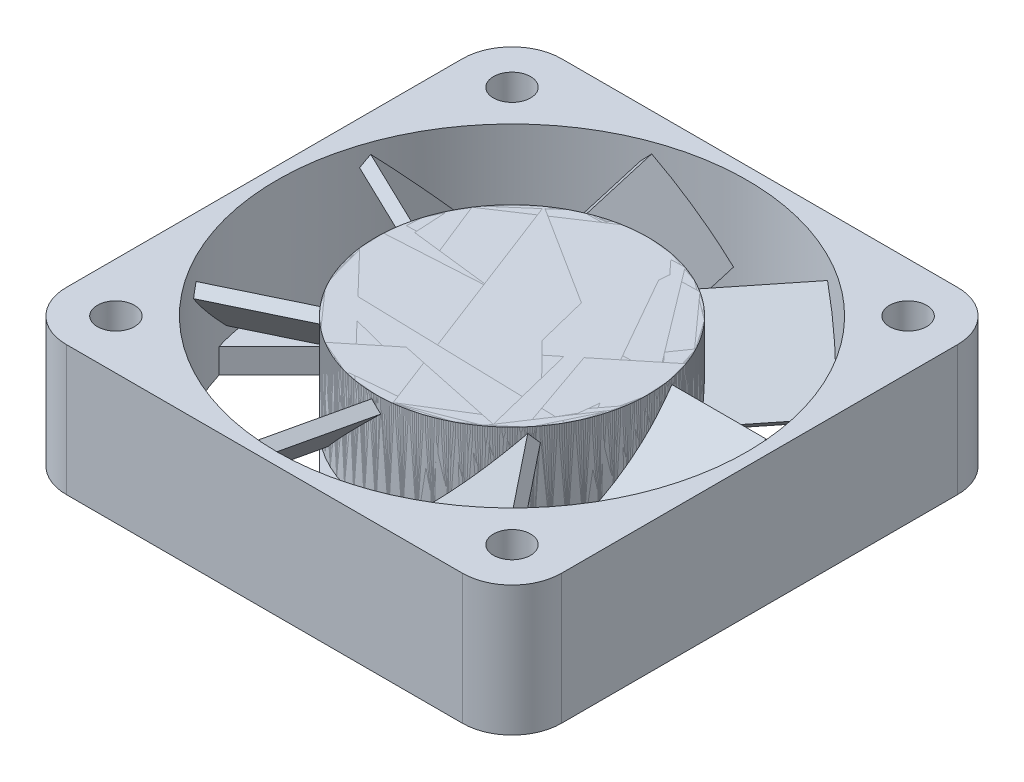
from build123d import *

# Parameters (mm, degrees)
SKETCH1_R                = 19
SKETCH1_R_2              = 1.5
BOSS_EXTRUDE1_DEPTH      = 10.5
BOSS_EXTRUDE2_DEPTH      = 2
SKETCH3_R                = 11
BOSS_EXTRUDE3_DEPTH      = 8
BOSS_EXTRUDE4_REACH      = 32.17
BOSS_EXTRUDE4_END_RADIUS = 18.5
CIRPATTERN3_COUNT        = 7


with BuildPart() as part:
    # Sketch1 → Boss-Extrude1 (new body)
    with BuildSketch(Plane(origin=(0, 0, 0), x_dir=(1, 0, 0), z_dir=(0, 1, 0))):
        with BuildLine():
            Line((-16, 20), (16, 20))
            ThreePointArc((16, 20), (18.828427125, 18.828427125), (20, 16))
            Line((20, 16), (20, -16))
            ThreePointArc((20, -16), (18.828427125, -18.828427125), (16, -20))
            Line((16, -20), (-16, -20))
            ThreePointArc((-16, -20), (-18.828427125, -18.828427125), (-20, -16))
            Line((-20, -16), (-20, 16))
            ThreePointArc((-20, 16), (-18.828427125, 18.828427125), (-16, 20))
        make_face()
        with Locations(Location((0, 0, 0), (0, 0, 90))):
            Circle(SKETCH1_R, mode=Mode.SUBTRACT)
        with Locations(Location((-16, 16, 0), (0, 0, 90))):
            Circle(SKETCH1_R_2, mode=Mode.SUBTRACT)
        with Locations(Location((16, 16, 0), (0, 0, 90))):
            Circle(SKETCH1_R_2, mode=Mode.SUBTRACT)
        with Locations(Location((16, -16, 0), (0, 0, 90))):
            Circle(SKETCH1_R_2, mode=Mode.SUBTRACT)
        with Locations(Location((-16, -16, 0), (0, 0, 90))):
            Circle(SKETCH1_R_2, mode=Mode.SUBTRACT)
    extrude(amount=BOSS_EXTRUDE1_DEPTH)

    # Sketch2 → Boss-Extrude2 (add)
    with BuildSketch(Plane.XZ):
        with BuildLine():
            Line((-7.778174593, 7.778174593), (3.176276557, 18.732625743))
            ThreePointArc((3.176276557, 18.732625743), (4.330553873, 18.499900085), (5.468198536, 18.196120597))
            Line((5.468198536, 18.196120597), (-1.891825076, 10.836096986))
            ThreePointArc((-1.891825076, 10.836096986), (3.31662479, 10.488088482), (7.778174593, 7.778174593))
            Line((7.778174593, 7.778174593), (18.732625743, -3.176276557))
            ThreePointArc((18.732625743, -3.176276557), (18.499900085, -4.330553873), (18.196120597, -5.468198536))
            Line((18.196120597, -5.468198536), (10.836096986, 1.891825076))
            ThreePointArc((10.836096986, 1.891825076), (10.488088482, -3.31662479), (7.778174593, -7.778174593))
            Line((7.778174593, -7.778174593), (-3.176276557, -18.732625743))
            ThreePointArc((-3.176276557, -18.732625743), (-4.330553873, -18.499900085), (-5.468198536, -18.196120597))
            Line((-5.468198536, -18.196120597), (1.891825076, -10.836096986))
            ThreePointArc((1.891825076, -10.836096986), (-3.31662479, -10.488088482), (-7.778174593, -7.778174593))
            Line((-7.778174593, -7.778174593), (-18.732625743, 3.176276557))
            ThreePointArc((-18.732625743, 3.176276557), (-18.499900085, 4.330553873), (-18.196120597, 5.468198536))
            Line((-18.196120597, 5.468198536), (-10.836096986, -1.891825076))
            ThreePointArc((-10.836096986, -1.891825076), (-10.488088482, 3.31662479), (-7.778174593, 7.778174593))
        make_face()
    extrude(amount=-BOSS_EXTRUDE2_DEPTH)


with BuildPart() as body_2:
    # Sketch3 → Boss-Extrude3 (new body)
    with BuildSketch(Plane(origin=(0, 10.5, 0), x_dir=(1, 0, 0), z_dir=(0, 1, 0))):
        with Locations(Location((0, 0, 0), (0, 0, 270))):
            Circle(SKETCH3_R)
    extrude(amount=-BOSS_EXTRUDE3_DEPTH)

    # Boss-Extrude4: up to this cylinder (the profile starts inside it)
    boss_extrude4_end = Plane(origin=(0, 6.853553, 0), z_dir=(0, -1, 0)) * Cylinder(BOSS_EXTRUDE4_END_RADIUS, 102.34, mode=Mode.PRIVATE)
    # Sketch4 → Boss-Extrude4 (add, up to the surface)
    with BuildSketch(Plane(origin=(0, 0, 0), x_dir=(0, 0, -1), z_dir=(1, 0, 0)), mode=Mode.PRIVATE) as boss_extrude4_sk1:
        Polygon((-3.535533906, 4.378679656), (2.121320344, 10.035533906), (2.828427125, 9.328427125), (-2.828427125, 3.671572875), align=None)
    boss_extrude4_tool1 = extrude(boss_extrude4_sk1.sketch, amount=BOSS_EXTRUDE4_REACH, mode=Mode.PRIVATE) & boss_extrude4_end
    add(boss_extrude4_tool1.solids().sort_by_distance((0, 6.853553, 0.353553))[0])


with BuildPart() as cirpattern3_1:
    # CirPattern3: pattern copy
    add(body_2.part.rotate(Axis((0, 0, 0), (0, 1, 0)), 1 * 360 / CIRPATTERN3_COUNT))


with BuildPart() as cirpattern3_2:
    # CirPattern3: pattern copy
    add(body_2.part.rotate(Axis((0, 0, 0), (0, 1, 0)), 2 * 360 / CIRPATTERN3_COUNT))


with BuildPart() as cirpattern3_3:
    # CirPattern3: pattern copy
    add(body_2.part.rotate(Axis((0, 0, 0), (0, 1, 0)), 3 * 360 / CIRPATTERN3_COUNT))


with BuildPart() as cirpattern3_4:
    # CirPattern3: pattern copy
    add(body_2.part.rotate(Axis((0, 0, 0), (0, 1, 0)), 4 * 360 / CIRPATTERN3_COUNT))


with BuildPart() as cirpattern3_5:
    # CirPattern3: pattern copy
    add(body_2.part.rotate(Axis((0, 0, 0), (0, 1, 0)), 5 * 360 / CIRPATTERN3_COUNT))


with BuildPart() as cirpattern3_6:
    # CirPattern3: pattern copy
    add(body_2.part.rotate(Axis((0, 0, 0), (0, 1, 0)), 6 * 360 / CIRPATTERN3_COUNT))


solid = Compound([part.part, body_2.part, cirpattern3_1.part, cirpattern3_2.part, cirpattern3_3.part, cirpattern3_4.part, cirpattern3_5.part, cirpattern3_6.part])
